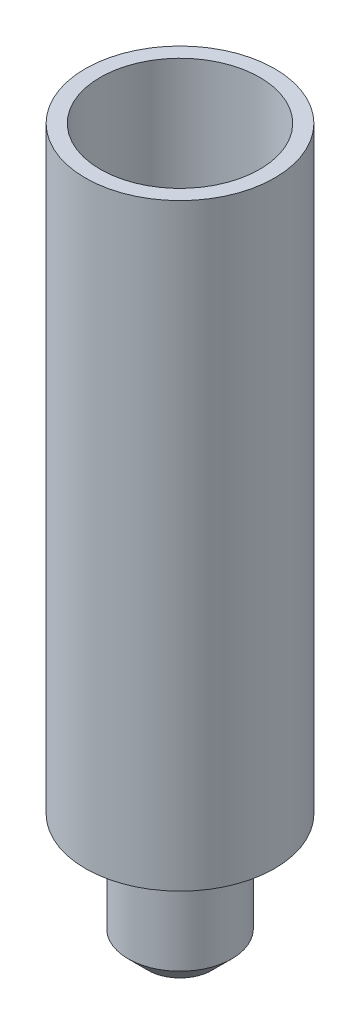
from build123d import *

# Parameters (mm, degrees)
SKETCH1_R                   = 2.6
BOSS_EXTRUDE1_DEPTH         = 6
SKETCH2_R                   = 4.75
BOSS_EXTRUDE3_DEPTH         = 2.5
SKETCH3_R                   = 4.75
SKETCH3_R_2                 = 4
BOSS_EXTRUDE4_DEPTH         = 27.5
M2_TAPPED_HOLE1_D           = 1.6
M2_TAPPED_HOLE1_CSINK_D     = 2.05
M2_TAPPED_HOLE1_CSINK_ANGLE = 90
CHAMFER3_SIZE               = 1


with BuildPart() as part:
    # Sketch1 → Boss-Extrude1 (new body)
    with BuildSketch(Plane(origin=(0, 0, 0), x_dir=(1, 0, 0), z_dir=(0, 1, 0))):
        with Locations(Location((0, 0, 0), (0, 0, 270))):
            Circle(SKETCH1_R)
    extrude(amount=BOSS_EXTRUDE1_DEPTH)

    # Sketch2 → Boss-Extrude3 (add)
    with BuildSketch(Plane(origin=(0, 6, 0), x_dir=(1, 0, 0), z_dir=(0, 1, 0))):
        with Locations(Location((0, 0, 0), (0, 0, 270))):
            Circle(SKETCH2_R)
    extrude(amount=BOSS_EXTRUDE3_DEPTH)

    # Sketch3 → Boss-Extrude4 (add)
    with BuildSketch(Plane(origin=(0, 8.5, 0), x_dir=(1, 0, 0), z_dir=(0, 1, 0))):
        with Locations(Location((0, 0, 0), (0, 0, 270))):
            Circle(SKETCH3_R)
        with Locations(Location((0, 0, 0), (0, 0, 270))):
            Circle(SKETCH3_R_2, mode=Mode.SUBTRACT)
    extrude(amount=BOSS_EXTRUDE4_DEPTH)

    # M2 Tapped Hole1 (through all)
    with Locations(Plane(origin=(0, 0, 0), x_dir=(-1, 0, 0), z_dir=(0, -1, 0))):
        with Locations((0, 0)):
            CounterSinkHole(M2_TAPPED_HOLE1_D / 2, M2_TAPPED_HOLE1_CSINK_D / 2, counter_sink_angle=M2_TAPPED_HOLE1_CSINK_ANGLE)

    # Chamfer3
    chamfer3_edges = [part.edges().sort_by_distance(p)[0] for p in [
        (0, 0, -2.6),
    ]]
    chamfer(chamfer3_edges, length=CHAMFER3_SIZE)


solid = part.part
